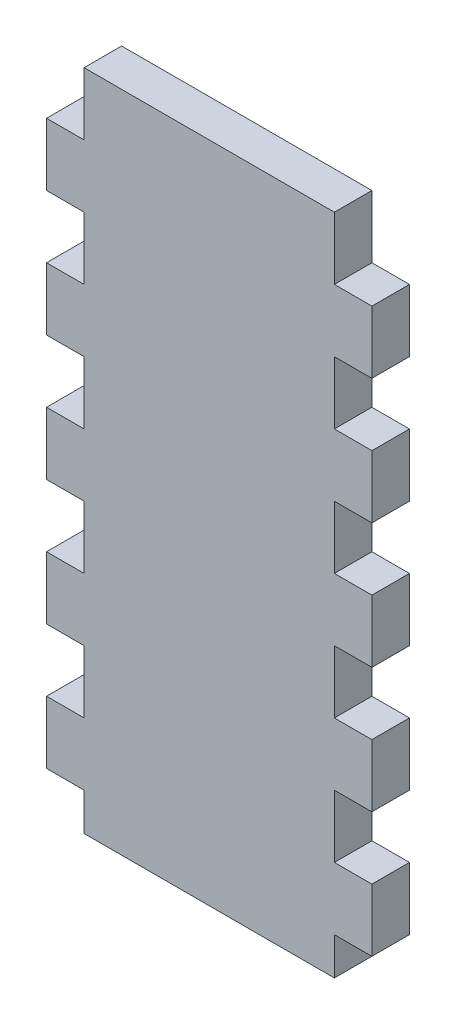
from build123d import *

# Parameters (mm, degrees)
RESSALTO_EXTRUS_O2_DEPTH = 3


with BuildPart() as part:
    # Esboço2 → Ressalto-extrusão2 (new body)
    with BuildSketch(Plane.XY):
        Polygon((-5.610733146, 21.516658845), (-5.610733146, 16.516658845), (-8.610733146, 16.516658845), (-8.610733146, 11.516658845), (-5.610733146, 11.516658845), (-5.610733146, 6.516658845), (-8.610733146, 6.516658845), (-8.610733146, 1.516658845), (-5.610733146, 1.516658845), (-5.610733146, -3.483341155), (-8.610733146, -3.483341155), (-8.610733146, -8.483341155), (-5.610733146, -8.483341155), (-5.610733146, -13.483341155), (-8.610733146, -13.483341155), (-8.610733146, -18.483341155), (-5.610733146, -18.483341155), (-5.610733146, -23.483341155), (-8.610733146, -23.483341155), (-8.610733146, -28.483341155), (-5.610733146, -28.483341155), (-5.610733146, -31.483341155), (14.389266854, -31.483341155), (14.389266854, -28.483341155), (17.389266854, -28.483341155), (17.38935519, -23.485447225), (14.38935519, -23.485447225), (14.38935519, -18.485447225), (17.38935519, -18.485447225), (17.38935519, -13.485447225), (14.38935519, -13.485447225), (14.38935519, -8.485447225), (17.38935519, -8.485447225), (17.38935519, -3.485447225), (14.38935519, -3.485447225), (14.38935519, 1.514552775), (17.391668394, 1.514552775), (17.391668394, 6.514552775), (14.389271599, 6.514552775), (14.389271599, 11.516658845), (17.389266854, 11.516658845), (17.389266854, 16.516658845), (14.389266854, 16.516658845), (14.389266854, 21.516658845), align=None)
    extrude(amount=RESSALTO_EXTRUS_O2_DEPTH)


solid = part.part
